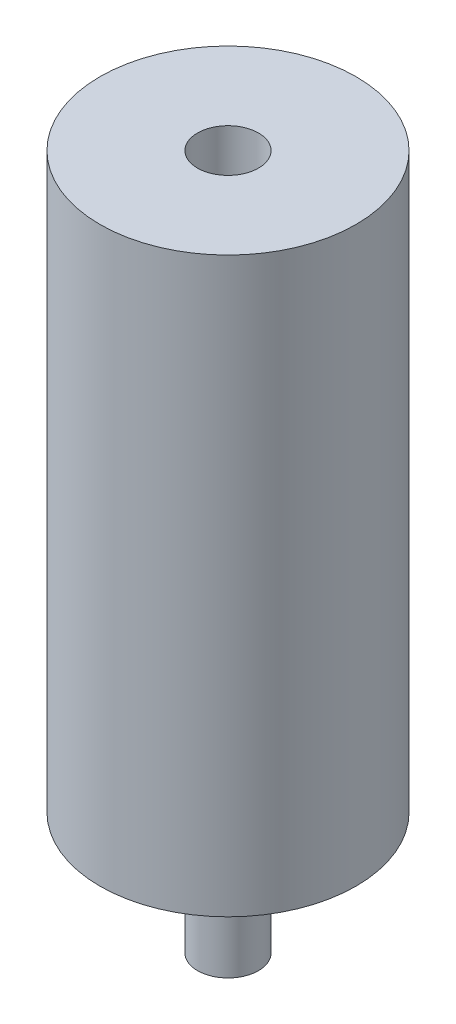
from build123d import *

# Parameters (mm, degrees)
SKETCH1_R           = 10.5
BOSS_EXTRUDE1_DEPTH = 47
SKETCH2_R           = 2.5
CUT_EXTRUDE1_DEPTH  = 10
SKETCH3_R           = 2.5
BOSS_EXTRUDE2_DEPTH = 10


with BuildPart() as part:
    # Sketch1 → Boss-Extrude1 (new body)
    with BuildSketch(Plane(origin=(0, 0, 0), x_dir=(1, 0, 0), z_dir=(0, 1, 0))):
        with Locations(Location((0, 0, 0), (0, 0, 270))):
            Circle(SKETCH1_R)
    extrude(amount=BOSS_EXTRUDE1_DEPTH)

    # Sketch2 → Cut-Extrude1 (cut)
    with BuildSketch(Plane(origin=(0, 47, 0), x_dir=(1, 0, 0), z_dir=(0, 1, 0))):
        with Locations(Location((0, 0, 0), (0, 0, 270))):
            Circle(SKETCH2_R)
    extrude(amount=-CUT_EXTRUDE1_DEPTH, mode=Mode.SUBTRACT)

    # Sketch3 → Boss-Extrude2 (add)
    with BuildSketch(Plane.XZ):
        with Locations(Location((0, 0, 0), (0, 0, 90))):
            Circle(SKETCH3_R)
    extrude(amount=BOSS_EXTRUDE2_DEPTH)


solid = part.part
